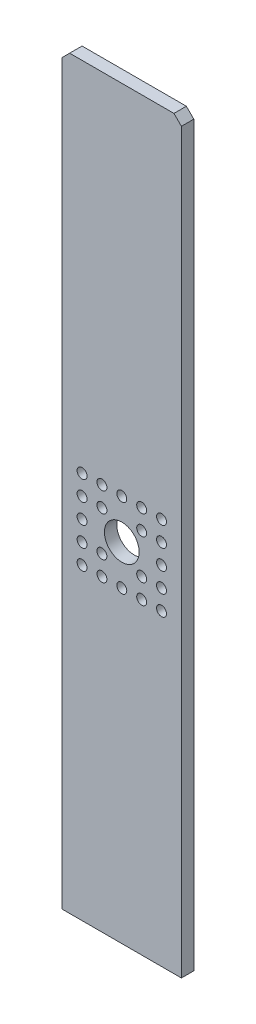
from build123d import *

# Parameters (mm, degrees)
SKETCH1_W           = 48
SKETCH1_H           = 300
SKETCH1_R           = 7
SKETCH1_R_2         = 2
BOSS_EXTRUDE1_DEPTH = 5
CHAMFER1_SIZE       = 3


with BuildPart() as part:
    # Sketch1 → Boss-Extrude1 (new body)
    with BuildSketch(Plane.XY):
        with Locations((24, -150)):
            Rectangle(SKETCH1_W, SKETCH1_H)
        with Locations((24, -160)):
            Circle(SKETCH1_R, mode=Mode.SUBTRACT)
        with Locations((8, -144)):
            Circle(SKETCH1_R_2, mode=Mode.SUBTRACT)
        with Locations((16, -144)):
            Circle(SKETCH1_R_2, mode=Mode.SUBTRACT)
        with Locations((24, -144)):
            Circle(SKETCH1_R_2, mode=Mode.SUBTRACT)
        with Locations((32, -144)):
            Circle(SKETCH1_R_2, mode=Mode.SUBTRACT)
        with Locations((40, -144)):
            Circle(SKETCH1_R_2, mode=Mode.SUBTRACT)
        with Locations((16, -152)):
            Circle(SKETCH1_R_2, mode=Mode.SUBTRACT)
        with Locations((32, -152)):
            Circle(SKETCH1_R_2, mode=Mode.SUBTRACT)
        with Locations((40, -152)):
            Circle(SKETCH1_R_2, mode=Mode.SUBTRACT)
        with Locations((40, -160)):
            Circle(SKETCH1_R_2, mode=Mode.SUBTRACT)
        with Locations((16, -168)):
            Circle(SKETCH1_R_2, mode=Mode.SUBTRACT)
        with Locations((32, -168)):
            Circle(SKETCH1_R_2, mode=Mode.SUBTRACT)
        with Locations((40, -168)):
            Circle(SKETCH1_R_2, mode=Mode.SUBTRACT)
        with Locations((16, -176)):
            Circle(SKETCH1_R_2, mode=Mode.SUBTRACT)
        with Locations((24, -176)):
            Circle(SKETCH1_R_2, mode=Mode.SUBTRACT)
        with Locations((32, -176)):
            Circle(SKETCH1_R_2, mode=Mode.SUBTRACT)
        with Locations((40, -176)):
            Circle(SKETCH1_R_2, mode=Mode.SUBTRACT)
        with Locations((8, -152)):
            Circle(SKETCH1_R_2, mode=Mode.SUBTRACT)
        with Locations((8, -160)):
            Circle(SKETCH1_R_2, mode=Mode.SUBTRACT)
        with Locations((8, -168)):
            Circle(SKETCH1_R_2, mode=Mode.SUBTRACT)
        with Locations((8, -176)):
            Circle(SKETCH1_R_2, mode=Mode.SUBTRACT)
    extrude(amount=BOSS_EXTRUDE1_DEPTH)

    # Chamfer1
    chamfer1_edges = [part.edges().sort_by_distance(p)[0] for p in [
        (48, 0, 2.5),
        (0, 0, 2.5),
    ]]
    chamfer(chamfer1_edges, length=CHAMFER1_SIZE)


solid = part.part
